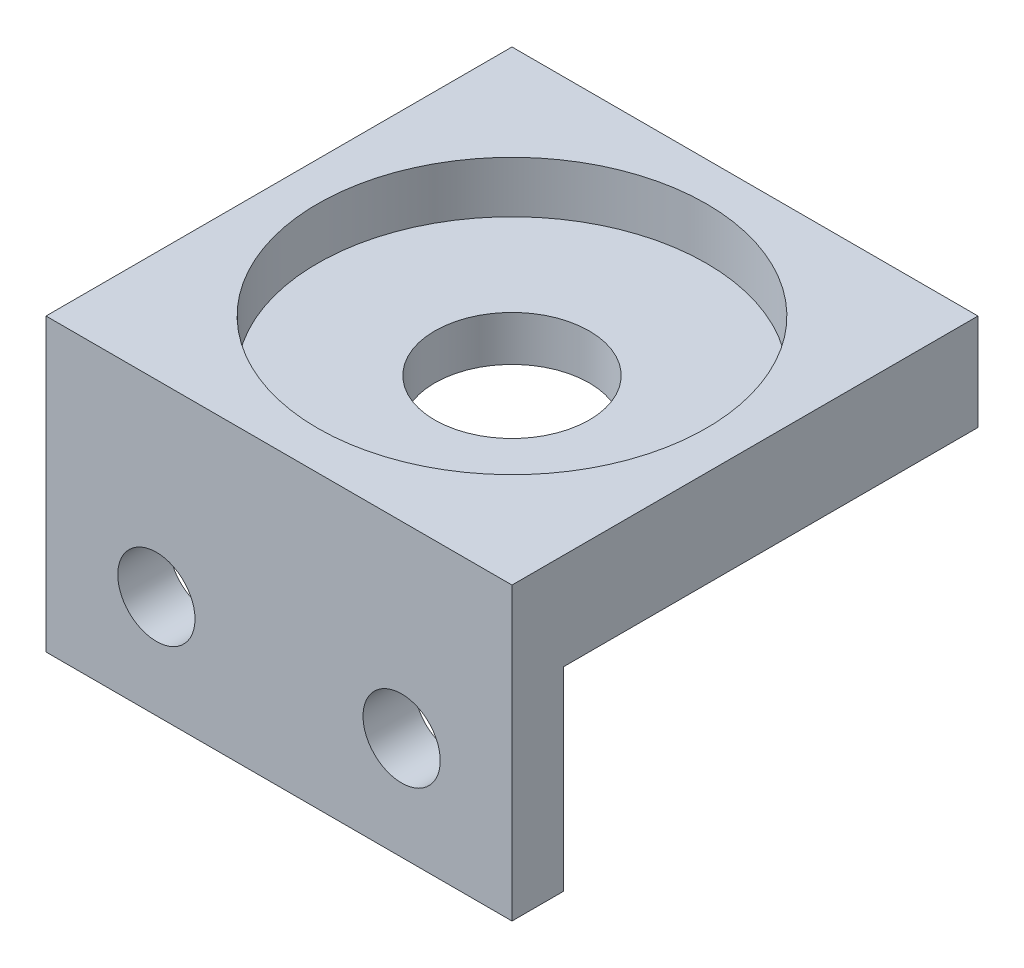
from build123d import *

# Parameters (mm, degrees)
SKETCH2_W           = 18.1
SKETCH2_H           = 18.1
SKETCH2_R           = 3
BOSS_EXTRUDE1_DEPTH = 3.75
CUT_EXTRUDE1_START  = 3.75
SKETCH2_3_R         = 7.55
CUT_EXTRUDE1_DEPTH  = 2
SKETCH3_W           = 18.1
SKETCH3_H           = 7.5525
SKETCH3_R           = 1.5
BOSS_EXTRUDE2_DEPTH = 2
BOSS_EXTRUDE3_DEPTH = 1


with BuildPart() as part:
    # Sketch2 → Boss-Extrude1 (new body)
    with BuildSketch(Plane(origin=(0, 0, 0), x_dir=(1, 0, 0), z_dir=(0, 1, 0))):
        with Locations((0, 9.05)):
            Rectangle(SKETCH2_W, SKETCH2_H)
        with Locations(Location((0, 9.05, 0), (0, 0, 270))):
            Circle(SKETCH2_R, mode=Mode.SUBTRACT)
    extrude(amount=BOSS_EXTRUDE1_DEPTH)

    # Sketch2<3> → Cut-Extrude1 (cut)
    with BuildSketch(Plane(origin=(0, 0, 0), x_dir=(1, 0, 0), z_dir=(0, 1, 0)).offset(CUT_EXTRUDE1_START)):
        with Locations(Location((0, 9.05, 0), (0, 0, 270))):
            Circle(SKETCH2_3_R)
    extrude(amount=-CUT_EXTRUDE1_DEPTH, mode=Mode.SUBTRACT)

    # Sketch3 → Boss-Extrude2 (add)
    with BuildSketch(Plane.XY):
        with Locations((0, -3.77625)):
            Rectangle(SKETCH3_W, SKETCH3_H)
        with Locations((4.7625, -3.5525)):
            Circle(SKETCH3_R, mode=Mode.SUBTRACT)
        with Locations((-4.7625, -3.5525)):
            Circle(SKETCH3_R, mode=Mode.SUBTRACT)
    extrude(amount=-BOSS_EXTRUDE2_DEPTH)

    # Sketch5 → Boss-Extrude3 (add, symmetric)
    with BuildSketch(Plane(origin=(0, 0, 0), x_dir=(0, 0, -1), z_dir=(1, 0, 0))):
        with BuildLine():
            Line((2, 0), (2, -7.5525))
            ThreePointArc((2, -7.5525), (3.076392083, -3.267562537), (6.05, 0))
            Line((6.05, 0), (2, 0))
        make_face()
    extrude(amount=BOSS_EXTRUDE3_DEPTH, both=True)


solid = part.part
